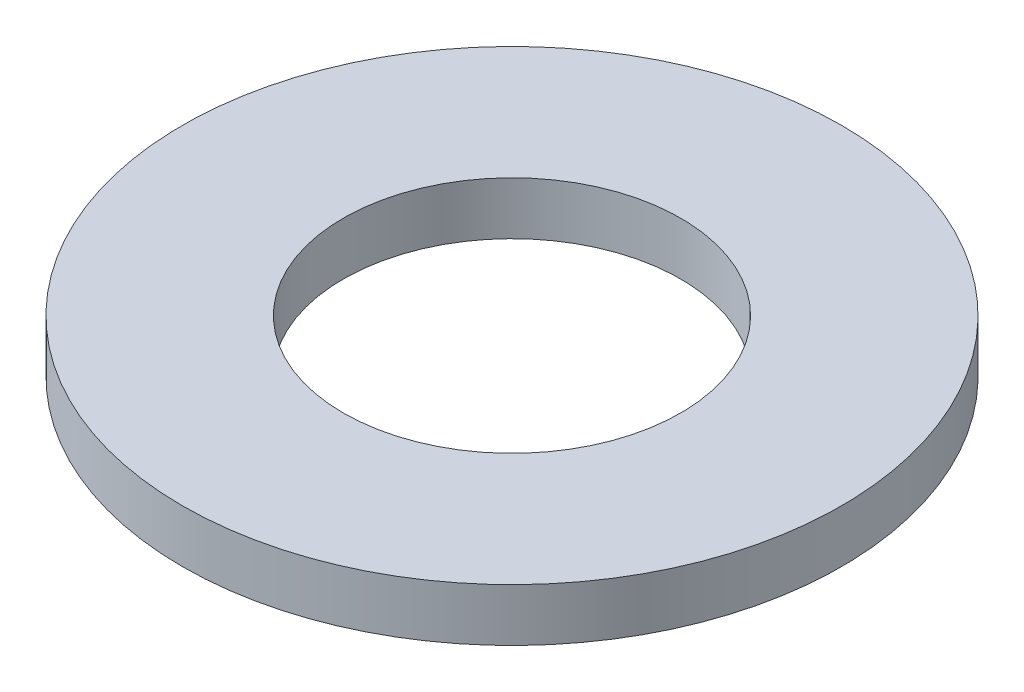
from build123d import *

# Parameters (mm, degrees)
SKETCH1_R           = 6.25
SKETCH1_R_2         = 3.2
BOSS_EXTRUDE1_DEPTH = 1


with BuildPart() as part:
    # Sketch1 → Boss-Extrude1 (new body)
    with BuildSketch(Plane(origin=(0, 0, 0), x_dir=(1, 0, 0), z_dir=(0, 1, 0))):
        with Locations(Location((0, 0, 0), (0, 0, 270))):
            Circle(SKETCH1_R)
        with Locations(Location((0, 0, 0), (0, 0, 270))):
            Circle(SKETCH1_R_2, mode=Mode.SUBTRACT)
    extrude(amount=BOSS_EXTRUDE1_DEPTH)


solid = part.part
